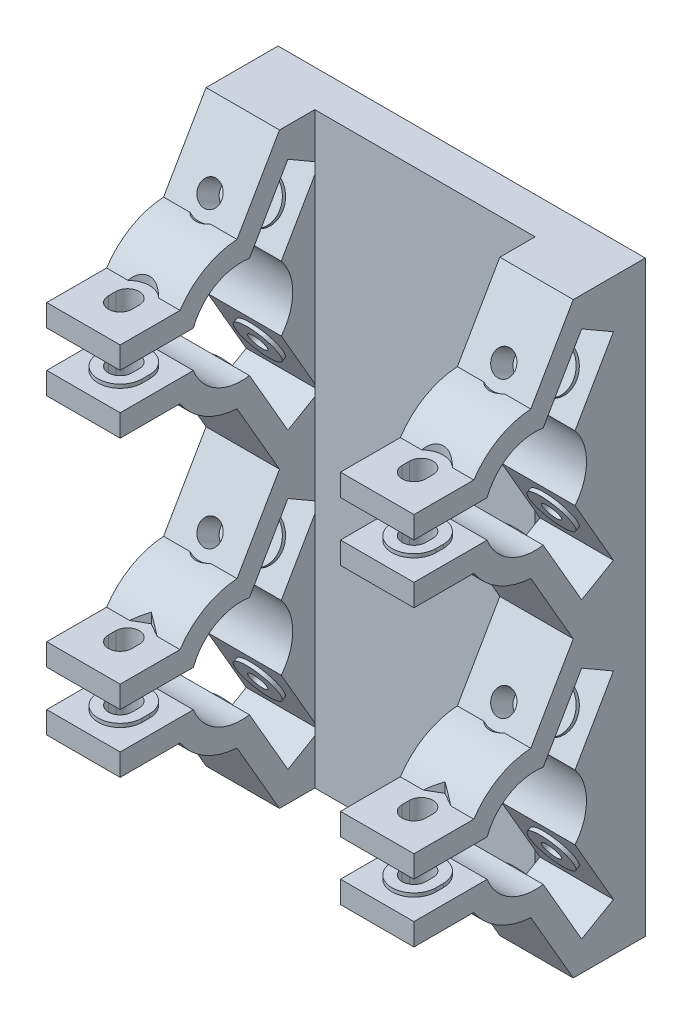
from build123d import *

# Parameters (mm, degrees)
SKETCH_1_W                = 5
SKETCH_1_H                = 80
EXTRUDE_1_DEPTH           = 50
EXTRUDE_2_DEPTH           = 10
SKETCH_6_W                = 10
SKETCH_6_H                = 3.813086718
CUT_EXTRUDE_10_DEPTH      = 1
SKETCH_2_R                = 3
EXTRUDE_3_DEPTH           = 0.5
EXTRUDE_START             = 4.5
SKETCH_2_3_R              = 3
EXTRUDE_4_DEPTH           = 0.5
CUT_EXTRUDE_START         = 0.5
SKETCH_2_4_R              = 1.25
CUT_EXTRUDE_1_DEPTH       = 10
CUT_EXTRUDE_START_2       = 8
SKETCH_2_5_R              = 3
CUT_EXTRUDE_4_DEPTH       = 1
CUT_EXTRUDE_START_3       = 4.5
SKETCH_2_6_R              = 1.6
CUT_EXTRUDE_5_DEPTH       = 3.5
EXTRUDE_START_2           = -3
EXTRUDE_5_DEPTH           = 0.5
EXTRUDE_START_3           = -7.5
EXTRUDE_6_DEPTH           = 0.5
CUT_EXTRUDE_START_4       = 2
CUT_EXTRUDE_6_DEPTH       = 2
CUT_EXTRUDE_7_DEPTH       = 11
CUT_EXTRUDE_8_DEPTH       = 2
MIRROR_6_COPY_1_SKETCH_W  = 10
MIRROR_6_COPY_1_SKETCH_H  = 3.813086718
MIRROR_6_COPY_1_DEPTH     = 1
MIRROR_6_COPY_2_SKETCH_R  = 3
MIRROR_6_COPY_2_DEPTH     = 0.5
MIRROR_START              = 4.5
MIRROR_6_COPY_3_SKETCH_R  = 3
MIRROR_6_COPY_3_DEPTH     = 0.5
MIRROR_START_2            = 0.5
MIRROR_6_COPY_4_SKETCH_R  = 1.25
MIRROR_6_COPY_4_DEPTH     = 10
MIRROR_START_3            = 8
MIRROR_6_COPY_5_SKETCH_R  = 3
MIRROR_6_COPY_5_DEPTH     = 1
MIRROR_6_COPY_6_SKETCH_R  = 1.6
MIRROR_6_COPY_6_DEPTH     = 3.5
MIRROR_7_COPY_1_SKETCH_W  = 10
MIRROR_7_COPY_1_SKETCH_H  = 3.813086718
MIRROR_7_COPY_1_DEPTH     = 1
MIRROR_7_COPY_2_SKETCH_R  = 3
MIRROR_7_COPY_2_DEPTH     = 0.5
MIRROR_7_COPY_3_SKETCH_R  = 3
MIRROR_7_COPY_3_DEPTH     = 0.5
MIRROR_7_COPY_4_SKETCH_R  = 1.25
MIRROR_7_COPY_4_DEPTH     = 10
MIRROR_7_COPY_5_SKETCH_R  = 3
MIRROR_7_COPY_5_DEPTH     = 1
MIRROR_7_COPY_6_SKETCH_R  = 1.6
MIRROR_7_COPY_6_DEPTH     = 3.5
MIRROR_7_COPY_7_DEPTH     = 10
MIRROR_7_COPY_8_SKETCH_W  = 10
MIRROR_7_COPY_8_SKETCH_H  = 3.813086718
MIRROR_7_COPY_8_DEPTH     = 1
MIRROR_7_COPY_9_SKETCH_R  = 3
MIRROR_7_COPY_9_DEPTH     = 0.5
MIRROR_7_COPY_10_SKETCH_R = 3
MIRROR_7_COPY_10_DEPTH    = 0.5
MIRROR_7_COPY_11_SKETCH_R = 1.25
MIRROR_7_COPY_11_DEPTH    = 10
MIRROR_7_COPY_12_SKETCH_R = 3
MIRROR_7_COPY_12_DEPTH    = 1
MIRROR_7_COPY_13_SKETCH_R = 1.6
MIRROR_7_COPY_13_DEPTH    = 3.5
MIRROR_START_4            = -3
MIRROR_7_COPY_14_DEPTH    = 0.5
MIRROR_START_5            = -7.5
MIRROR_7_COPY_15_DEPTH    = 0.5
MIRROR_START_6            = 2
MIRROR_7_COPY_16_DEPTH    = 2
MIRROR_7_COPY_17_DEPTH    = 11
MIRROR_7_COPY_18_DEPTH    = 2
MIRROR_7_COPY_19_SKETCH_W = 10
MIRROR_7_COPY_19_SKETCH_H = 3.813086718
MIRROR_7_COPY_19_DEPTH    = 1
MIRROR_7_COPY_20_SKETCH_R = 3
MIRROR_7_COPY_20_DEPTH    = 0.5
MIRROR_7_COPY_21_SKETCH_R = 3
MIRROR_7_COPY_21_DEPTH    = 0.5
MIRROR_7_COPY_22_SKETCH_R = 1.25
MIRROR_7_COPY_22_DEPTH    = 10
MIRROR_7_COPY_23_SKETCH_R = 3
MIRROR_7_COPY_23_DEPTH    = 1
MIRROR_7_COPY_24_SKETCH_R = 1.6
MIRROR_7_COPY_24_DEPTH    = 3.5


with BuildPart() as part:
    # Эскиз1 → Бобышка-Вытянуть1 (new body)
    with BuildSketch(Plane(origin=(0, 0, 0), x_dir=(0, 0, -1), z_dir=(1, 0, 0))):
        with Locations((2.5, 0)):
            Rectangle(SKETCH_1_W, SKETCH_1_H)
    extrude(amount=EXTRUDE_1_DEPTH)

    # Эскиз1<3> → Бобышка-Вытянуть2 (add)
    with BuildSketch(Plane(origin=(0, 0, 0), x_dir=(0, 0, -1), z_dir=(1, 0, 0))):
        with BuildLine():
            Line((-4.803847577, 0), (0, 0))
            Line((0, 0), (0, 6.143593539))
            Line((0, 6.143593539), (-3.665063509, 4.027568136))
            Line((-3.665063509, 4.027568136), (-8.895889302, 13.087624174))
            ThreePointArc((-8.895889302, 13.087624174), (-13.5, 13.937822174), (-16.538348415, 17.5))
            Line((-16.538348415, 17.5), (-26.5, 17.5))
            Line((-26.5, 17.5), (-26.5, 14.5))
            Line((-26.5, 14.5), (-18.351646544, 14.5))
            ThreePointArc((-18.351646544, 14.5), (-15, 11.339745962), (-10.587316449, 10.017261929))
            Line((-10.587316449, 10.017261929), (-4.803847577, 0))
        make_face()
        with BuildLine():
            Line((-4.565762283, 15.587624174), (0, 7.679491924))
            Line((0, 7.679491924), (0, 32.320508076))
            Line((0, 32.320508076), (-4.565762283, 24.412375826))
            ThreePointArc((-4.565762283, 24.412375826), (-3, 20), (-4.565762283, 15.587624174))
        make_face()
        with BuildLine():
            Line((0, 33.856406461), (0, 40))
            Line((0, 40), (-4.803847577, 40))
            Line((-4.803847577, 40), (-10.587316449, 29.982738071))
            ThreePointArc((-10.587316449, 29.982738071), (-15, 28.660254038), (-18.351646544, 25.5))
            Line((-18.351646544, 25.5), (-26.5, 25.5))
            Line((-26.5, 25.5), (-26.5, 22.5))
            Line((-26.5, 22.5), (-16.538348415, 22.5))
            ThreePointArc((-16.538348415, 22.5), (-13.5, 26.062177826), (-8.895889302, 26.912375826))
            Line((-8.895889302, 26.912375826), (-3.665063509, 35.972431864))
            Line((-3.665063509, 35.972431864), (0, 33.856406461))
        make_face()
    extrude_2 = extrude(amount=EXTRUDE_2_DEPTH)

    # Эскиз6 → Вырез-Вытянуть10 (cut)
    with BuildSketch(Plane(origin=(0, 8.080127019, 13.995190528), x_dir=(1, 0, 0), z_dir=(0, 0.4999999999999973, 0.8660254037844403))):
        with Locations((5, 27.413964717)):
            Rectangle(SKETCH_6_W, SKETCH_6_H)
    cut_extrude_10 = extrude(amount=CUT_EXTRUDE_10_DEPTH, mode=Mode.SUBTRACT)

    # Эскиз2 → Бобышка-Вытянуть3 (add)
    with BuildSketch(Plane(origin=(0, 8.080127019, 13.995190528), x_dir=(1, 0, 0), z_dir=(0, 0.4999999999999973, 0.8660254037844403))):
        with Locations((5, 23.320508076)):
            Circle(SKETCH_2_R)
    extrude_3 = extrude(amount=EXTRUDE_3_DEPTH)

    # Эскиз2<3> → Бобышка-Вытянуть4 (add)
    with BuildSketch(Plane(origin=(0, 8.080127019, 13.995190528), x_dir=(1, 0, 0), z_dir=(0, 0.4999999999999973, 0.8660254037844403)).offset(EXTRUDE_START)):
        with Locations((5, 23.320508076)):
            Circle(SKETCH_2_3_R)
    extrude_4 = extrude(amount=EXTRUDE_4_DEPTH)

    # Эскиз2<4> → Вырез-Вытянуть1 (cut)
    with BuildSketch(Plane(origin=(0, 8.080127019, 13.995190528), x_dir=(1, 0, 0), z_dir=(0, 0.4999999999999973, 0.8660254037844403)).offset(CUT_EXTRUDE_START)):
        with Locations((5, 23.320508076)):
            Circle(SKETCH_2_4_R)
    cut_extrude_1 = extrude(amount=-CUT_EXTRUDE_1_DEPTH, mode=Mode.SUBTRACT)

    # Эскиз2<5> → Вырез-Вытянуть4 (cut)
    with BuildSketch(Plane(origin=(0, 8.080127019, 13.995190528), x_dir=(1, 0, 0), z_dir=(0, 0.4999999999999973, 0.8660254037844403)).offset(CUT_EXTRUDE_START_2)):
        with Locations((5, 23.320508076)):
            Circle(SKETCH_2_5_R)
    cut_extrude_4 = extrude(amount=CUT_EXTRUDE_4_DEPTH, mode=Mode.SUBTRACT)

    # Эскиз2<6> → Вырез-Вытянуть5 (cut)
    with BuildSketch(Plane(origin=(0, 8.080127019, 13.995190528), x_dir=(1, 0, 0), z_dir=(0, 0.4999999999999973, 0.8660254037844403)).offset(CUT_EXTRUDE_START_3)):
        with Locations((5, 23.320508076)):
            Circle(SKETCH_2_6_R)
    cut_extrude_5 = extrude(amount=CUT_EXTRUDE_5_DEPTH, mode=Mode.SUBTRACT)

    # Зеркальное отражение3: Вырез-Вытянуть10, Бобышка-Вытянуть3, Бобышка-Вытянуть4, Вырез-Вытянуть1, Вырез-Вытянуть4, Вырез-Вытянуть5 across plane
    add(cut_extrude_10.mirror(Plane(origin=(0, 20, 0), x_dir=(0, 0, 1), z_dir=(0, -1, 0))), mode=Mode.SUBTRACT)
    add(extrude_3.mirror(Plane(origin=(0, 20, 0), x_dir=(0, 0, 1), z_dir=(0, -1, 0))))
    add(extrude_4.mirror(Plane(origin=(0, 20, 0), x_dir=(0, 0, 1), z_dir=(0, -1, 0))))
    add(cut_extrude_1.mirror(Plane(origin=(0, 20, 0), x_dir=(0, 0, 1), z_dir=(0, -1, 0))), mode=Mode.SUBTRACT)
    add(cut_extrude_4.mirror(Plane(origin=(0, 20, 0), x_dir=(0, 0, 1), z_dir=(0, -1, 0))), mode=Mode.SUBTRACT)
    add(cut_extrude_5.mirror(Plane(origin=(0, 20, 0), x_dir=(0, 0, 1), z_dir=(0, -1, 0))), mode=Mode.SUBTRACT)

    # Эскиз3 → Бобышка-Вытянуть5 (add)
    with BuildSketch(Plane(origin=(0, 25.5, 0), x_dir=(1, 0, 0), z_dir=(0, 1, 0)).offset(EXTRUDE_START_2)):
        with BuildLine():
            Line((8, -20.5), (8, -21.5))
            ThreePointArc((8, -21.5), (5, -24.5), (2, -21.5))
            Line((2, -21.5), (2, -20.5))
            ThreePointArc((2, -20.5), (5, -17.5), (8, -20.5))
        make_face()
    extrude_5 = extrude(amount=-EXTRUDE_5_DEPTH)

    # Эскиз3<3> → Бобышка-Вытянуть6 (add)
    with BuildSketch(Plane(origin=(0, 25.5, 0), x_dir=(1, 0, 0), z_dir=(0, 1, 0)).offset(EXTRUDE_START_3)):
        with BuildLine():
            Line((8, -20.5), (8, -21.5))
            ThreePointArc((8, -21.5), (5, -24.5), (2, -21.5))
            Line((2, -21.5), (2, -20.5))
            ThreePointArc((2, -20.5), (5, -17.5), (8, -20.5))
        make_face()
    extrude_6 = extrude(amount=-EXTRUDE_6_DEPTH)

    # Эскиз3<4> → Вырез-Вытянуть6 (cut)
    with BuildSketch(Plane(origin=(0, 25.5, 0), x_dir=(1, 0, 0), z_dir=(0, 1, 0)).offset(CUT_EXTRUDE_START_4)):
        with BuildLine():
            Line((8, -20.5), (8, -21.5))
            ThreePointArc((8, -21.5), (5, -24.5), (2, -21.5))
            Line((2, -21.5), (2, -20.5))
            ThreePointArc((2, -20.5), (5, -17.5), (8, -20.5))
        make_face()
        with BuildLine():
            Line((6.6, -20.5), (6.6, -21.5))
            ThreePointArc((6.6, -21.5), (5, -23.1), (3.4, -21.5))
            Line((3.4, -21.5), (3.4, -20.5))
            ThreePointArc((3.4, -20.5), (5, -18.9), (6.6, -20.5))
        make_face(mode=Mode.SUBTRACT)
    cut_extrude_6 = extrude(amount=-CUT_EXTRUDE_6_DEPTH, mode=Mode.SUBTRACT)

    # Эскиз3<6> → Вырез-Вытянуть7 (cut)
    with BuildSketch(Plane(origin=(0, 25.5, 0), x_dir=(1, 0, 0), z_dir=(0, 1, 0))):
        with BuildLine():
            Line((6.6, -20.5), (6.6, -21.5))
            ThreePointArc((6.6, -21.5), (5, -23.1), (3.4, -21.5))
            Line((3.4, -21.5), (3.4, -20.5))
            ThreePointArc((3.4, -20.5), (5, -18.9), (6.6, -20.5))
        make_face()
    cut_extrude_7 = extrude(amount=-CUT_EXTRUDE_7_DEPTH, mode=Mode.SUBTRACT)

    # Эскиз4 → Вырез-Вытянуть8 (cut)
    with BuildSketch(Plane.XZ.offset(-14.5)):
        Polygon((5, 17.266838493), (7.8, 18.883419246), (7.8, 22.116580754), (5, 23.733161507), (2.2, 22.116580754), (2.2, 18.883419246), align=None)
    cut_extrude_8 = extrude(amount=CUT_EXTRUDE_8_DEPTH, mode=Mode.SUBTRACT)

    # Зеркальное отражение6: Бобышка-Вытянуть2, Вырез-Вытянуть10, Бобышка-Вытянуть3, Бобышка-Вытянуть4, Вырез-Вытянуть1, Вырез-Вытянуть4, Вырез-Вытянуть5, Бобышка-Вытянуть5, Бобышка-Вытянуть6, Вырез-Вытянуть6, Вырез-Вытянуть7, Вырез-Вытянуть8 across plane
    add(extrude_2.mirror(Plane(origin=(25, 0, 0), x_dir=(0, 0, 1), z_dir=(1, 0, 0))))
    add(cut_extrude_10.mirror(Plane(origin=(25, 0, 0), x_dir=(0, 0, 1), z_dir=(1, 0, 0))), mode=Mode.SUBTRACT)
    add(extrude_3.mirror(Plane(origin=(25, 0, 0), x_dir=(0, 0, 1), z_dir=(1, 0, 0))))
    add(extrude_4.mirror(Plane(origin=(25, 0, 0), x_dir=(0, 0, 1), z_dir=(1, 0, 0))))
    add(cut_extrude_1.mirror(Plane(origin=(25, 0, 0), x_dir=(0, 0, 1), z_dir=(1, 0, 0))), mode=Mode.SUBTRACT)
    add(cut_extrude_4.mirror(Plane(origin=(25, 0, 0), x_dir=(0, 0, 1), z_dir=(1, 0, 0))), mode=Mode.SUBTRACT)
    add(cut_extrude_5.mirror(Plane(origin=(25, 0, 0), x_dir=(0, 0, 1), z_dir=(1, 0, 0))), mode=Mode.SUBTRACT)
    add(extrude_5.mirror(Plane(origin=(25, 0, 0), x_dir=(0, 0, 1), z_dir=(1, 0, 0))))
    add(extrude_6.mirror(Plane(origin=(25, 0, 0), x_dir=(0, 0, 1), z_dir=(1, 0, 0))))
    add(cut_extrude_6.mirror(Plane(origin=(25, 0, 0), x_dir=(0, 0, 1), z_dir=(1, 0, 0))), mode=Mode.SUBTRACT)
    add(cut_extrude_7.mirror(Plane(origin=(25, 0, 0), x_dir=(0, 0, 1), z_dir=(1, 0, 0))), mode=Mode.SUBTRACT)
    add(cut_extrude_8.mirror(Plane(origin=(25, 0, 0), x_dir=(0, 0, 1), z_dir=(1, 0, 0))), mode=Mode.SUBTRACT)

    # Зеркальное отражение6 copy 1 sketch → Зеркальное отражение6 copy 1 (cut)
    with BuildSketch(Plane(origin=(50, 31.919872981, 13.995190528), x_dir=(-1, 0, 0), z_dir=(0, -0.4999999999999973, 0.8660254037844403))):
        with Locations((5, 27.413964717)):
            Rectangle(MIRROR_6_COPY_1_SKETCH_W, MIRROR_6_COPY_1_SKETCH_H)
    extrude(amount=MIRROR_6_COPY_1_DEPTH, mode=Mode.SUBTRACT)

    # Зеркальное отражение6 copy 2 sketch → Зеркальное отражение6 copy 2 (add)
    with BuildSketch(Plane(origin=(50, 31.919872981, 13.995190528), x_dir=(-1, 0, 0), z_dir=(0, -0.4999999999999973, 0.8660254037844403))):
        with Locations((5, 23.320508076)):
            Circle(MIRROR_6_COPY_2_SKETCH_R)
    extrude(amount=MIRROR_6_COPY_2_DEPTH)

    # Зеркальное отражение6 copy 3 sketch → Зеркальное отражение6 copy 3 (add)
    with BuildSketch(Plane(origin=(50, 31.919872981, 13.995190528), x_dir=(-1, 0, 0), z_dir=(0, -0.4999999999999973, 0.8660254037844403)).offset(MIRROR_START)):
        with Locations((5, 23.320508076)):
            Circle(MIRROR_6_COPY_3_SKETCH_R)
    extrude(amount=MIRROR_6_COPY_3_DEPTH)

    # Зеркальное отражение6 copy 4 sketch → Зеркальное отражение6 copy 4 (cut)
    with BuildSketch(Plane(origin=(50, 31.919872981, 13.995190528), x_dir=(-1, 0, 0), z_dir=(0, -0.4999999999999973, 0.8660254037844403)).offset(MIRROR_START_2)):
        with Locations((5, 23.320508076)):
            Circle(MIRROR_6_COPY_4_SKETCH_R)
    extrude(amount=-MIRROR_6_COPY_4_DEPTH, mode=Mode.SUBTRACT)

    # Зеркальное отражение6 copy 5 sketch → Зеркальное отражение6 copy 5 (cut)
    with BuildSketch(Plane(origin=(50, 31.919872981, 13.995190528), x_dir=(-1, 0, 0), z_dir=(0, -0.4999999999999973, 0.8660254037844403)).offset(MIRROR_START_3)):
        with Locations((5, 23.320508076)):
            Circle(MIRROR_6_COPY_5_SKETCH_R)
    extrude(amount=MIRROR_6_COPY_5_DEPTH, mode=Mode.SUBTRACT)

    # Зеркальное отражение6 copy 6 sketch → Зеркальное отражение6 copy 6 (cut)
    with BuildSketch(Plane(origin=(50, 31.919872981, 13.995190528), x_dir=(-1, 0, 0), z_dir=(0, -0.4999999999999973, 0.8660254037844403)).offset(MIRROR_START)):
        with Locations((5, 23.320508076)):
            Circle(MIRROR_6_COPY_6_SKETCH_R)
    extrude(amount=MIRROR_6_COPY_6_DEPTH, mode=Mode.SUBTRACT)

    # Зеркальное отражение7: Бобышка-Вытянуть2, Вырез-Вытянуть10, Бобышка-Вытянуть3, Бобышка-Вытянуть4, Вырез-Вытянуть1, Вырез-Вытянуть4, Вырез-Вытянуть5, Бобышка-Вытянуть5, Бобышка-Вытянуть6, Вырез-Вытянуть6, Вырез-Вытянуть7, Вырез-Вытянуть8 across plane
    add(extrude_2.mirror(Plane(origin=(10, 0, 0), x_dir=(0, 0, 1), z_dir=(0, 1, 0))))
    add(cut_extrude_10.mirror(Plane(origin=(10, 0, 0), x_dir=(0, 0, 1), z_dir=(0, 1, 0))), mode=Mode.SUBTRACT)
    add(extrude_3.mirror(Plane(origin=(10, 0, 0), x_dir=(0, 0, 1), z_dir=(0, 1, 0))))
    add(extrude_4.mirror(Plane(origin=(10, 0, 0), x_dir=(0, 0, 1), z_dir=(0, 1, 0))))
    add(cut_extrude_1.mirror(Plane(origin=(10, 0, 0), x_dir=(0, 0, 1), z_dir=(0, 1, 0))), mode=Mode.SUBTRACT)
    add(cut_extrude_4.mirror(Plane(origin=(10, 0, 0), x_dir=(0, 0, 1), z_dir=(0, 1, 0))), mode=Mode.SUBTRACT)
    add(cut_extrude_5.mirror(Plane(origin=(10, 0, 0), x_dir=(0, 0, 1), z_dir=(0, 1, 0))), mode=Mode.SUBTRACT)
    add(extrude_5.mirror(Plane(origin=(10, 0, 0), x_dir=(0, 0, 1), z_dir=(0, 1, 0))))
    add(extrude_6.mirror(Plane(origin=(10, 0, 0), x_dir=(0, 0, 1), z_dir=(0, 1, 0))))
    add(cut_extrude_6.mirror(Plane(origin=(10, 0, 0), x_dir=(0, 0, 1), z_dir=(0, 1, 0))), mode=Mode.SUBTRACT)
    add(cut_extrude_7.mirror(Plane(origin=(10, 0, 0), x_dir=(0, 0, 1), z_dir=(0, 1, 0))), mode=Mode.SUBTRACT)
    add(cut_extrude_8.mirror(Plane(origin=(10, 0, 0), x_dir=(0, 0, 1), z_dir=(0, 1, 0))), mode=Mode.SUBTRACT)

    # Зеркальное отражение7 copy 1 sketch → Зеркальное отражение7 copy 1 (cut)
    with BuildSketch(Plane(origin=(0, -31.919872981, 13.995190528), x_dir=(1, 0, 0), z_dir=(0, 0.4999999999999973, 0.8660254037844403))):
        with Locations((5, 27.413964717)):
            Rectangle(MIRROR_7_COPY_1_SKETCH_W, MIRROR_7_COPY_1_SKETCH_H)
    extrude(amount=MIRROR_7_COPY_1_DEPTH, mode=Mode.SUBTRACT)

    # Зеркальное отражение7 copy 2 sketch → Зеркальное отражение7 copy 2 (add)
    with BuildSketch(Plane(origin=(0, -31.919872981, 13.995190528), x_dir=(1, 0, 0), z_dir=(0, 0.4999999999999973, 0.8660254037844403))):
        with Locations((5, 23.320508076)):
            Circle(MIRROR_7_COPY_2_SKETCH_R)
    extrude(amount=MIRROR_7_COPY_2_DEPTH)

    # Зеркальное отражение7 copy 3 sketch → Зеркальное отражение7 copy 3 (add)
    with BuildSketch(Plane(origin=(0, -31.919872981, 13.995190528), x_dir=(1, 0, 0), z_dir=(0, 0.4999999999999973, 0.8660254037844403)).offset(MIRROR_START)):
        with Locations((5, 23.320508076)):
            Circle(MIRROR_7_COPY_3_SKETCH_R)
    extrude(amount=MIRROR_7_COPY_3_DEPTH)

    # Зеркальное отражение7 copy 4 sketch → Зеркальное отражение7 copy 4 (cut)
    with BuildSketch(Plane(origin=(0, -31.919872981, 13.995190528), x_dir=(1, 0, 0), z_dir=(0, 0.4999999999999973, 0.8660254037844403)).offset(MIRROR_START_2)):
        with Locations((5, 23.320508076)):
            Circle(MIRROR_7_COPY_4_SKETCH_R)
    extrude(amount=-MIRROR_7_COPY_4_DEPTH, mode=Mode.SUBTRACT)

    # Зеркальное отражение7 copy 5 sketch → Зеркальное отражение7 copy 5 (cut)
    with BuildSketch(Plane(origin=(0, -31.919872981, 13.995190528), x_dir=(1, 0, 0), z_dir=(0, 0.4999999999999973, 0.8660254037844403)).offset(MIRROR_START_3)):
        with Locations((5, 23.320508076)):
            Circle(MIRROR_7_COPY_5_SKETCH_R)
    extrude(amount=MIRROR_7_COPY_5_DEPTH, mode=Mode.SUBTRACT)

    # Зеркальное отражение7 copy 6 sketch → Зеркальное отражение7 copy 6 (cut)
    with BuildSketch(Plane(origin=(0, -31.919872981, 13.995190528), x_dir=(1, 0, 0), z_dir=(0, 0.4999999999999973, 0.8660254037844403)).offset(MIRROR_START)):
        with Locations((5, 23.320508076)):
            Circle(MIRROR_7_COPY_6_SKETCH_R)
    extrude(amount=MIRROR_7_COPY_6_DEPTH, mode=Mode.SUBTRACT)

    # Зеркальное отражение7 copy 7 sketch → Зеркальное отражение7 copy 7 (add)
    with BuildSketch(Plane(origin=(50, 0, 0), x_dir=(0, 0, -1), z_dir=(-1, 0, 0))):
        with BuildLine():
            Line((-4.803847577, 0), (0, 0))
            Line((0, 0), (0, 6.143593539))
            Line((0, 6.143593539), (-3.665063509, 4.027568136))
            Line((-3.665063509, 4.027568136), (-8.895889302, 13.087624174))
            ThreePointArc((-8.895889302, 13.087624174), (-13.5, 13.937822174), (-16.538348415, 17.5))
            Line((-16.538348415, 17.5), (-26.5, 17.5))
            Line((-26.5, 17.5), (-26.5, 14.5))
            Line((-26.5, 14.5), (-18.351646544, 14.5))
            ThreePointArc((-18.351646544, 14.5), (-15, 11.339745962), (-10.587316449, 10.017261929))
            Line((-10.587316449, 10.017261929), (-4.803847577, 0))
        make_face()
        with BuildLine():
            Line((-4.565762283, 15.587624174), (0, 7.679491924))
            Line((0, 7.679491924), (0, 32.320508076))
            Line((0, 32.320508076), (-4.565762283, 24.412375826))
            ThreePointArc((-4.565762283, 24.412375826), (-3, 20), (-4.565762283, 15.587624174))
        make_face()
        with BuildLine():
            Line((0, 33.856406461), (0, 40))
            Line((0, 40), (-4.803847577, 40))
            Line((-4.803847577, 40), (-10.587316449, 29.982738071))
            ThreePointArc((-10.587316449, 29.982738071), (-15, 28.660254038), (-18.351646544, 25.5))
            Line((-18.351646544, 25.5), (-26.5, 25.5))
            Line((-26.5, 25.5), (-26.5, 22.5))
            Line((-26.5, 22.5), (-16.538348415, 22.5))
            ThreePointArc((-16.538348415, 22.5), (-13.5, 26.062177826), (-8.895889302, 26.912375826))
            Line((-8.895889302, 26.912375826), (-3.665063509, 35.972431864))
            Line((-3.665063509, 35.972431864), (0, 33.856406461))
        make_face()
    extrude(amount=MIRROR_7_COPY_7_DEPTH)

    # Зеркальное отражение7 copy 8 sketch → Зеркальное отражение7 copy 8 (cut)
    with BuildSketch(Plane(origin=(50, -8.080127019, 13.995190528), x_dir=(-1, 0, 0), z_dir=(0, -0.4999999999999973, 0.8660254037844403))):
        with Locations((5, 27.413964717)):
            Rectangle(MIRROR_7_COPY_8_SKETCH_W, MIRROR_7_COPY_8_SKETCH_H)
    extrude(amount=MIRROR_7_COPY_8_DEPTH, mode=Mode.SUBTRACT)

    # Зеркальное отражение7 copy 9 sketch → Зеркальное отражение7 copy 9 (add)
    with BuildSketch(Plane(origin=(50, -8.080127019, 13.995190528), x_dir=(-1, 0, 0), z_dir=(0, -0.4999999999999973, 0.8660254037844403))):
        with Locations((5, 23.320508076)):
            Circle(MIRROR_7_COPY_9_SKETCH_R)
    extrude(amount=MIRROR_7_COPY_9_DEPTH)

    # Зеркальное отражение7 copy 10 sketch → Зеркальное отражение7 copy 10 (add)
    with BuildSketch(Plane(origin=(50, -8.080127019, 13.995190528), x_dir=(-1, 0, 0), z_dir=(0, -0.4999999999999973, 0.8660254037844403)).offset(MIRROR_START)):
        with Locations((5, 23.320508076)):
            Circle(MIRROR_7_COPY_10_SKETCH_R)
    extrude(amount=MIRROR_7_COPY_10_DEPTH)

    # Зеркальное отражение7 copy 11 sketch → Зеркальное отражение7 copy 11 (cut)
    with BuildSketch(Plane(origin=(50, -8.080127019, 13.995190528), x_dir=(-1, 0, 0), z_dir=(0, -0.4999999999999973, 0.8660254037844403)).offset(MIRROR_START_2)):
        with Locations((5, 23.320508076)):
            Circle(MIRROR_7_COPY_11_SKETCH_R)
    extrude(amount=-MIRROR_7_COPY_11_DEPTH, mode=Mode.SUBTRACT)

    # Зеркальное отражение7 copy 12 sketch → Зеркальное отражение7 copy 12 (cut)
    with BuildSketch(Plane(origin=(50, -8.080127019, 13.995190528), x_dir=(-1, 0, 0), z_dir=(0, -0.4999999999999973, 0.8660254037844403)).offset(MIRROR_START_3)):
        with Locations((5, 23.320508076)):
            Circle(MIRROR_7_COPY_12_SKETCH_R)
    extrude(amount=MIRROR_7_COPY_12_DEPTH, mode=Mode.SUBTRACT)

    # Зеркальное отражение7 copy 13 sketch → Зеркальное отражение7 copy 13 (cut)
    with BuildSketch(Plane(origin=(50, -8.080127019, 13.995190528), x_dir=(-1, 0, 0), z_dir=(0, -0.4999999999999973, 0.8660254037844403)).offset(MIRROR_START)):
        with Locations((5, 23.320508076)):
            Circle(MIRROR_7_COPY_13_SKETCH_R)
    extrude(amount=MIRROR_7_COPY_13_DEPTH, mode=Mode.SUBTRACT)

    # Зеркальное отражение7 copy 14 sketch → Зеркальное отражение7 copy 14 (add)
    with BuildSketch(Plane(origin=(50, -25.5, 0), x_dir=(-1, 0, 0), z_dir=(0, -1, 0)).offset(MIRROR_START_4)):
        with BuildLine():
            Line((8, -20.5), (8, -21.5))
            ThreePointArc((8, -21.5), (5, -24.5), (2, -21.5))
            Line((2, -21.5), (2, -20.5))
            ThreePointArc((2, -20.5), (5, -17.5), (8, -20.5))
        make_face()
    extrude(amount=-MIRROR_7_COPY_14_DEPTH)

    # Зеркальное отражение7 copy 15 sketch → Зеркальное отражение7 copy 15 (add)
    with BuildSketch(Plane(origin=(50, -25.5, 0), x_dir=(-1, 0, 0), z_dir=(0, -1, 0)).offset(MIRROR_START_5)):
        with BuildLine():
            Line((8, -20.5), (8, -21.5))
            ThreePointArc((8, -21.5), (5, -24.5), (2, -21.5))
            Line((2, -21.5), (2, -20.5))
            ThreePointArc((2, -20.5), (5, -17.5), (8, -20.5))
        make_face()
    extrude(amount=-MIRROR_7_COPY_15_DEPTH)

    # Зеркальное отражение7 copy 16 sketch → Зеркальное отражение7 copy 16 (cut)
    with BuildSketch(Plane(origin=(50, -25.5, 0), x_dir=(-1, 0, 0), z_dir=(0, -1, 0)).offset(MIRROR_START_6)):
        with BuildLine():
            Line((8, -20.5), (8, -21.5))
            ThreePointArc((8, -21.5), (5, -24.5), (2, -21.5))
            Line((2, -21.5), (2, -20.5))
            ThreePointArc((2, -20.5), (5, -17.5), (8, -20.5))
        make_face()
        with BuildLine():
            Line((6.6, -20.5), (6.6, -21.5))
            ThreePointArc((6.6, -21.5), (5, -23.1), (3.4, -21.5))
            Line((3.4, -21.5), (3.4, -20.5))
            ThreePointArc((3.4, -20.5), (5, -18.9), (6.6, -20.5))
        make_face(mode=Mode.SUBTRACT)
    extrude(amount=-MIRROR_7_COPY_16_DEPTH, mode=Mode.SUBTRACT)

    # Зеркальное отражение7 copy 17 sketch → Зеркальное отражение7 copy 17 (cut)
    with BuildSketch(Plane(origin=(50, -25.5, 0), x_dir=(-1, 0, 0), z_dir=(0, -1, 0))):
        with BuildLine():
            Line((6.6, -20.5), (6.6, -21.5))
            ThreePointArc((6.6, -21.5), (5, -23.1), (3.4, -21.5))
            Line((3.4, -21.5), (3.4, -20.5))
            ThreePointArc((3.4, -20.5), (5, -18.9), (6.6, -20.5))
        make_face()
    extrude(amount=-MIRROR_7_COPY_17_DEPTH, mode=Mode.SUBTRACT)

    # Зеркальное отражение7 copy 18 sketch → Зеркальное отражение7 copy 18 (cut)
    with BuildSketch(Plane(origin=(50, -14.5, 0), x_dir=(-1, 0, 0), z_dir=(0, 1, 0))):
        Polygon((5, 17.266838493), (7.8, 18.883419246), (7.8, 22.116580754), (5, 23.733161507), (2.2, 22.116580754), (2.2, 18.883419246), align=None)
    extrude(amount=MIRROR_7_COPY_18_DEPTH, mode=Mode.SUBTRACT)

    # Зеркальное отражение7 copy 19 sketch → Зеркальное отражение7 copy 19 (cut)
    with BuildSketch(Plane(origin=(50, -31.919872981, 13.995190528), x_dir=(-1, 0, 0), z_dir=(0, 0.4999999999999973, 0.8660254037844403))):
        with Locations((5, -27.413964717)):
            Rectangle(MIRROR_7_COPY_19_SKETCH_W, MIRROR_7_COPY_19_SKETCH_H)
    extrude(amount=MIRROR_7_COPY_19_DEPTH, mode=Mode.SUBTRACT)

    # Зеркальное отражение7 copy 20 sketch → Зеркальное отражение7 copy 20 (add)
    with BuildSketch(Plane(origin=(50, -31.919872981, 13.995190528), x_dir=(-1, 0, 0), z_dir=(0, 0.4999999999999973, 0.8660254037844403))):
        with Locations((5, -23.320508076)):
            Circle(MIRROR_7_COPY_20_SKETCH_R)
    extrude(amount=MIRROR_7_COPY_20_DEPTH)

    # Зеркальное отражение7 copy 21 sketch → Зеркальное отражение7 copy 21 (add)
    with BuildSketch(Plane(origin=(50, -31.919872981, 13.995190528), x_dir=(-1, 0, 0), z_dir=(0, 0.4999999999999973, 0.8660254037844403)).offset(MIRROR_START)):
        with Locations((5, -23.320508076)):
            Circle(MIRROR_7_COPY_21_SKETCH_R)
    extrude(amount=MIRROR_7_COPY_21_DEPTH)

    # Зеркальное отражение7 copy 22 sketch → Зеркальное отражение7 copy 22 (cut)
    with BuildSketch(Plane(origin=(50, -31.919872981, 13.995190528), x_dir=(-1, 0, 0), z_dir=(0, 0.4999999999999973, 0.8660254037844403)).offset(MIRROR_START_2)):
        with Locations((5, -23.320508076)):
            Circle(MIRROR_7_COPY_22_SKETCH_R)
    extrude(amount=-MIRROR_7_COPY_22_DEPTH, mode=Mode.SUBTRACT)

    # Зеркальное отражение7 copy 23 sketch → Зеркальное отражение7 copy 23 (cut)
    with BuildSketch(Plane(origin=(50, -31.919872981, 13.995190528), x_dir=(-1, 0, 0), z_dir=(0, 0.4999999999999973, 0.8660254037844403)).offset(MIRROR_START_3)):
        with Locations((5, -23.320508076)):
            Circle(MIRROR_7_COPY_23_SKETCH_R)
    extrude(amount=MIRROR_7_COPY_23_DEPTH, mode=Mode.SUBTRACT)

    # Зеркальное отражение7 copy 24 sketch → Зеркальное отражение7 copy 24 (cut)
    with BuildSketch(Plane(origin=(50, -31.919872981, 13.995190528), x_dir=(-1, 0, 0), z_dir=(0, 0.4999999999999973, 0.8660254037844403)).offset(MIRROR_START)):
        with Locations((5, -23.320508076)):
            Circle(MIRROR_7_COPY_24_SKETCH_R)
    extrude(amount=MIRROR_7_COPY_24_DEPTH, mode=Mode.SUBTRACT)


solid = part.part
